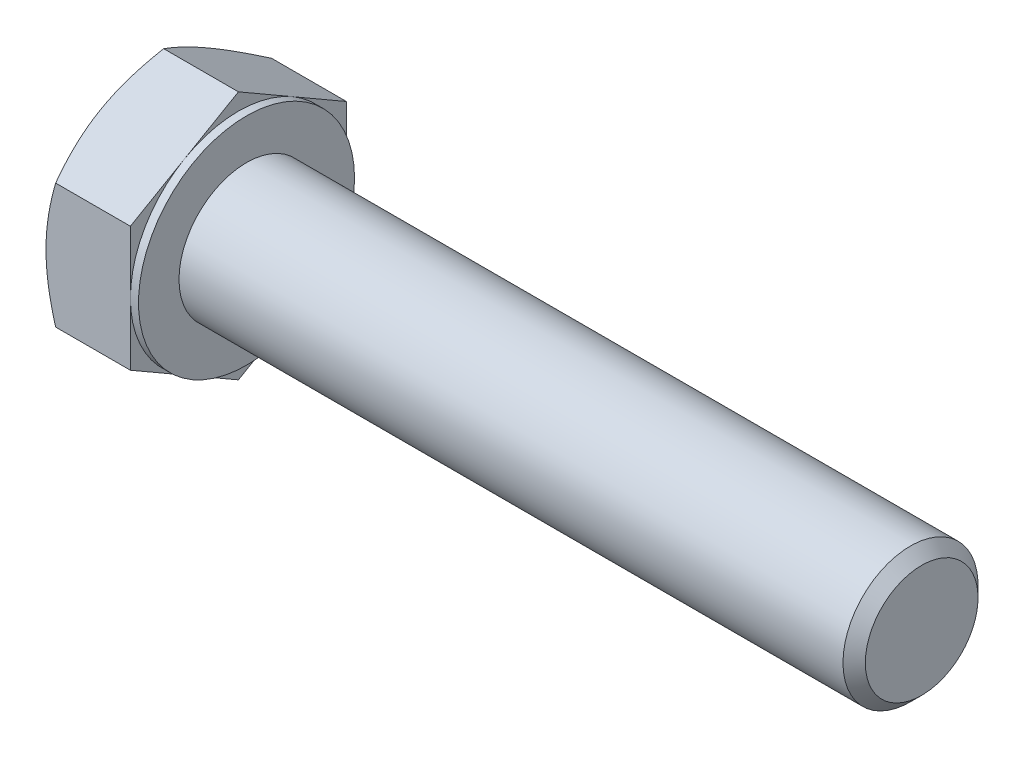
from build123d import *

# Parameters (mm, degrees)
BASEHEAD_DEPTH = 6.85
SKETCH4_W      = 0.6
SKETCH4_H      = 11.237604307


with BuildPart() as part:
    # Sketch1 → BaseHead (new body)
    with BuildSketch(Plane(origin=(0, 0, 0), x_dir=(0, 0, -1), z_dir=(1, 0, 0))):
        Polygon((8, 4.618802154), (8, -4.618802154), (0, -9.237604307), (-8, -4.618802154), (-8, 4.618802154), (0, 9.237604307), align=None)
    extrude(amount=BASEHEAD_DEPTH)

    # BodySke → BaseBody (revolve)
    with BuildSketch(Plane.XY, mode=Mode.PRIVATE) as basebody_sk:
        Polygon((0, 0), (56.85, 0), (56.85, 4.172), (56.022, 5), (0, 5), align=None)
    revolve(basebody_sk.sketch.rotate(Axis((0, 0, 0), (1, 0, 0)), 90), axis=Axis((0, 0, 0), (1, 0, 0)))

    # Sketch3 → HeadChamfer (revolve, cut)
    with BuildSketch(Plane.XY):
        Polygon((0, 8), (3.601282526, 14.237604307), (3.601282526, 19.237604307), (-10, 19.237604307), (-10, 8), align=None)
    revolve(axis=Axis((0, 0, 0), (1, 0, 0)), mode=Mode.SUBTRACT)

    # Sketch4 → BearingFace (revolve, cut)
    with BuildSketch(Plane.XY, mode=Mode.PRIVATE) as bearingface_sk:
        with Locations((6.55, 13.618802154)):
            Rectangle(SKETCH4_W, SKETCH4_H)
    revolve(bearingface_sk.sketch.rotate(Axis((0, 0, 0), (1, 0, 0)), 270), axis=Axis((0, 0, 0), (1, 0, 0)), mode=Mode.SUBTRACT)


solid = part.part
